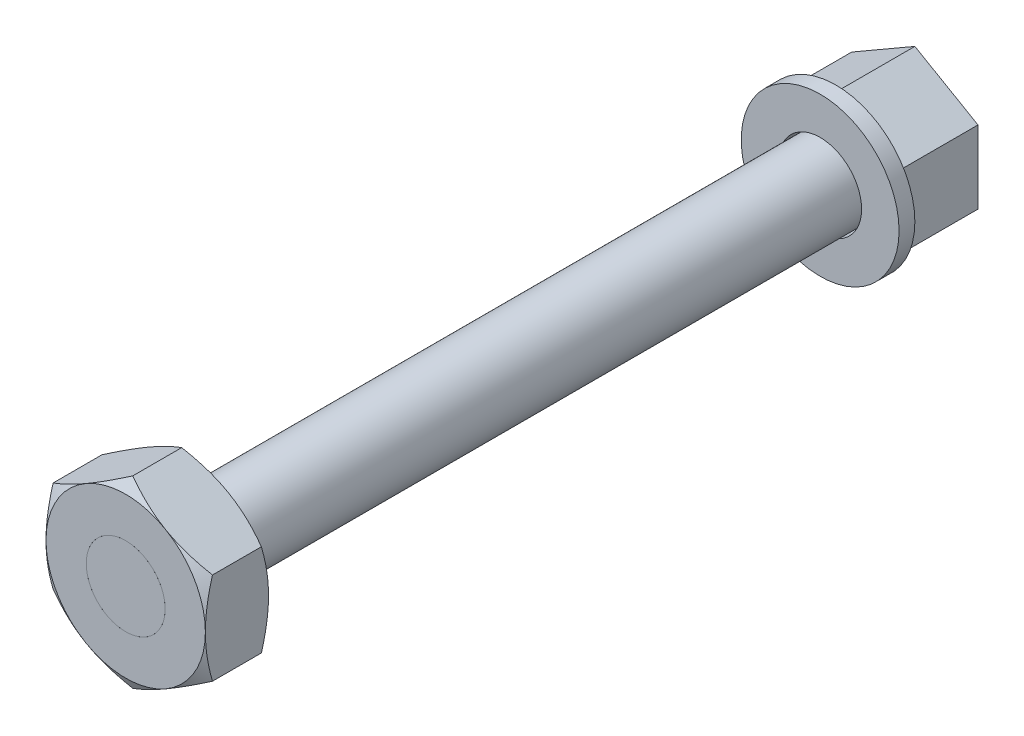
from build123d import *

# Parameters (mm, degrees)
SKETCH1_R           = 5
BOSS_EXTRUDE1_DEPTH = 10
BOSS_EXTRUDE2_START = 10
SKETCH1_3_R         = 5
BOSS_EXTRUDE2_DEPTH = 90
BOSS_EXTRUDE3_START = 10
SKETCH3_R           = 10
SKETCH3_R_2         = 5.25
BOSS_EXTRUDE3_DEPTH = 2
SKETCH4_R           = 5
BOSS_EXTRUDE4_DEPTH = 8


with BuildPart() as part:
    # Sketch1 → Boss-Extrude1 (new body)
    # profile 1 of 2: a face of its own
    with BuildSketch(Plane.XY):
        Polygon((-11.163210479, -1.701501358), (-3.163210479, 2.917300796), (-3.163210479, 12.154905103), (-11.163210479, 16.773707256), (-19.163210479, 12.154905103), (-19.163210479, 2.917300796), align=None)
        with Locations((-11.163210479, 7.536102949)):
            Circle(SKETCH1_R, mode=Mode.SUBTRACT)
    # profile 2 of 2: a face of its own
    with BuildSketch(Plane.XY):
        with Locations((-11.163210479, 7.536102949)):
            Circle(SKETCH1_R)
    extrude(amount=BOSS_EXTRUDE1_DEPTH)

    # Sketch1<3> → Boss-Extrude2 (add)
    with BuildSketch(Plane.XY.offset(BOSS_EXTRUDE2_START)):
        with Locations(Location((-11.163210479, 7.536102949, 0), (0, 0, 180))):
            Circle(SKETCH1_3_R)
    extrude(amount=BOSS_EXTRUDE2_DEPTH)


with BuildPart() as body_2:
    # Sketch3 → Boss-Extrude3 (new body)
    with BuildSketch(Plane.XY.offset(BOSS_EXTRUDE3_START)):
        with Locations((-11.163210479, 7.536102949)):
            Circle(SKETCH3_R)
        with Locations((-11.163210479, 7.536102949)):
            Circle(SKETCH3_R_2, mode=Mode.SUBTRACT)
    extrude(amount=BOSS_EXTRUDE3_DEPTH)


with BuildPart() as body_3:
    # Sketch4 → Boss-Extrude4 (new body)
    with BuildSketch(Plane.XY.offset(100)):
        Polygon((-11.163210479, -4.123618998), (-1.065595071, 1.706241975), (-1.065595071, 13.365963923), (-11.163210479, 19.195824897), (-21.260825886, 13.365963923), (-21.260825886, 1.706241975), align=None)
        with Locations((-11.163210479, 7.536102949)):
            Circle(SKETCH4_R, mode=Mode.SUBTRACT)
    extrude(amount=-BOSS_EXTRUDE4_DEPTH)

    # Sketch5 → Cut-Revolve1 (revolve, cut)
    with BuildSketch(Plane(origin=(0, 7.536102949, 0), x_dir=(-1, 0, 0), z_dir=(0, -1, 0))):
        Polygon((28.189029116, -96), (14.332622656, -104), (14.332622656, -108.5), (39.332622656, -108.5), (39.332622656, -83.5), (14.332622656, -83.5), (14.332622656, -88), align=None)
    revolve(axis=Axis((-11.163210479, 7.536102949, 51.6), (0, 0, 1)), mode=Mode.SUBTRACT)


solid = Compound([part.part, body_2.part, body_3.part])
